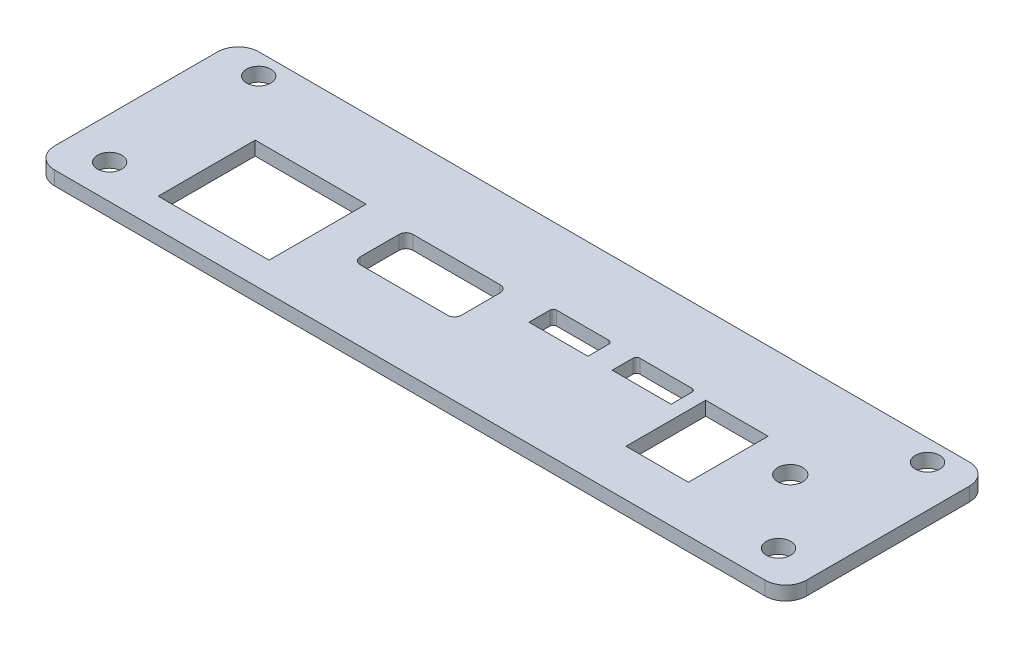
from build123d import *

# Parameters (mm, degrees)
SKETCH1_W           = 108.5
SKETCH1_H           = 29.5
BOSS_EXTRUDE1_DEPTH = 2
SKETCH2_R           = 1.75
CUT_EXTRUDE1_DEPTH  = 113.456658318
FILLET1_R           = 3
SKETCH5_R           = 1.8
SKETCH5_W           = 16
SKETCH5_H           = 14
SKETCH5_W_2         = 14.6
SKETCH5_H_2         = 7.6
SKETCH5_W_3         = 9
SKETCH5_H_3         = 11.5
CUT_EXTRUDE2_DEPTH  = 113.456658318
FILLET2_R           = 1
FILLET3_R           = 0.5


with BuildPart() as part:
    # Sketch1 → Boss-Extrude1 (new body)
    with BuildSketch(Plane(origin=(0, 0, 0), x_dir=(1, 0, 0), z_dir=(0, 1, 0))):
        with Locations((54.25, 14.75)):
            Rectangle(SKETCH1_W, SKETCH1_H)
    extrude(amount=BOSS_EXTRUDE1_DEPTH)

    # Sketch2 → Cut-Extrude1 (cut, through all)
    with BuildSketch(Plane(origin=(0, 2, 0), x_dir=(1, 0, 0), z_dir=(0, 1, 0))):
        with Locations(Location((6, 26.45, 0), (0, 0, 270))):
            Circle(SKETCH2_R)
        with Locations(Location((6, 4.95, 0), (0, 0, 270))):
            Circle(SKETCH2_R)
        with Locations(Location((102.5, 4.95, 0), (0, 0, 90))):
            Circle(SKETCH2_R)
        with Locations(Location((102.5, 26.45, 0), (0, 0, 90))):
            Circle(SKETCH2_R)
    extrude(amount=-CUT_EXTRUDE1_DEPTH, mode=Mode.SUBTRACT)

    # Fillet1
    fillet1_edges = [part.edges().sort_by_distance(p)[0] for p in [
        (0, 1, -29.5),
        (108.5, 1, -29.5),
        (108.5, 1, 0),
        (0, 1, 0),
    ]]
    fillet(fillet1_edges, radius=FILLET1_R)

    # Sketch5 → Cut-Extrude2 (cut, through all)
    with BuildSketch(Plane(origin=(0, 2, 0), x_dir=(1, 0, 0), z_dir=(0, 1, 0))):
        with Locations(Location((94.15, 15, 0), (0, 0, 270))):
            Circle(SKETCH5_R)
        with Locations((21.75, 11.2)):
            Rectangle(SKETCH5_W, SKETCH5_H)
        with Locations((43.2, 14)):
            Rectangle(SKETCH5_W_2, SKETCH5_H_2)
        Polygon((56.25, 18.2), (56.25, 15.2), (64.75, 15.2), (64.75, 18.2), (64.75, 18.7), (56.25, 18.7), align=None)
        Polygon((68.25, 18.2), (68.25, 15.2), (76.75, 15.2), (76.75, 18.2), (76.75, 18.7), (68.25, 18.7), align=None)
        with Locations((83.25, 12.45)):
            Rectangle(SKETCH5_W_3, SKETCH5_H_3)
    extrude(amount=-CUT_EXTRUDE2_DEPTH, mode=Mode.SUBTRACT)

    # Fillet2
    fillet2_edges = [part.edges().sort_by_distance(p)[0] for p in [
        (50.5, 1, -10.2),
        (35.9, 1, -10.2),
        (35.9, 1, -17.8),
        (50.5, 1, -17.8),
    ]]
    fillet(fillet2_edges, radius=FILLET2_R)

    # Fillet3
    fillet3_edges = [part.edges().sort_by_distance(p)[0] for p in [
        (56.25, 1, -18.7),
        (64.75, 1, -18.7),
        (68.25, 1, -18.7),
        (76.75, 1, -18.7),
    ]]
    fillet(fillet3_edges, radius=FILLET3_R)


solid = part.part
